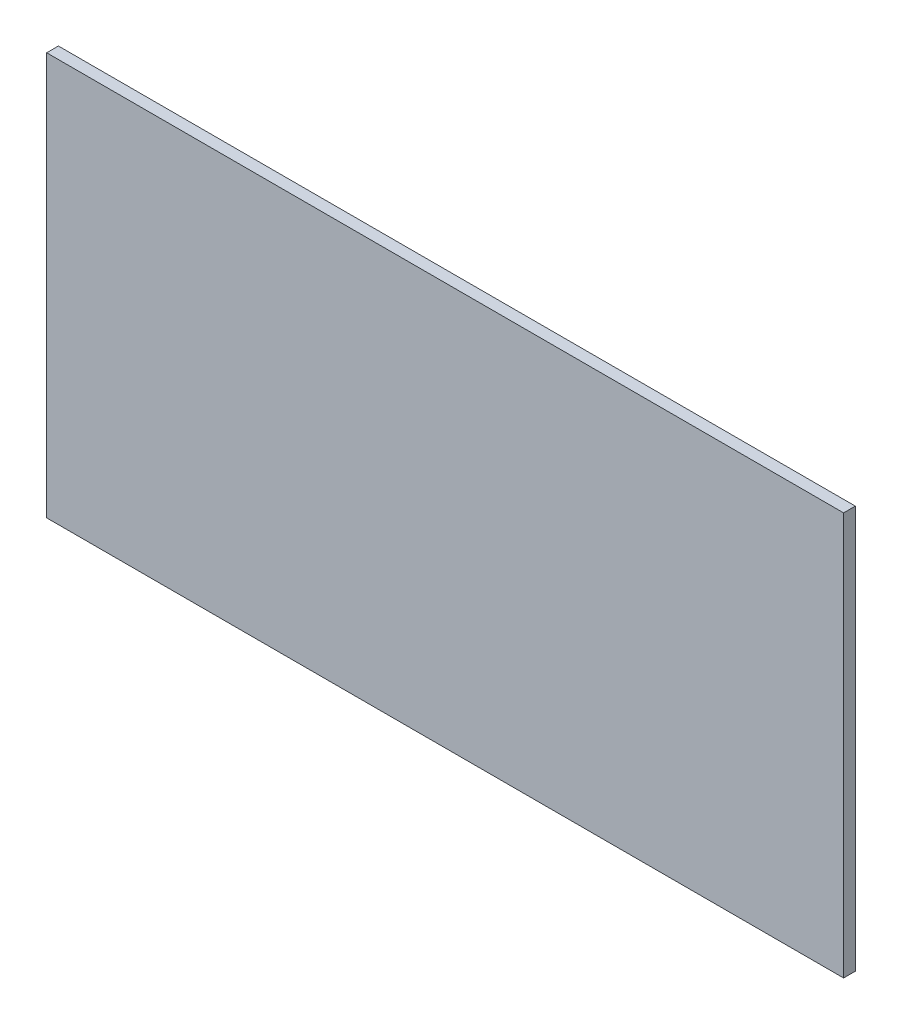
from build123d import *

# Parameters (mm, degrees)
SKETCH1_W           = 108.780149608
SKETCH1_H           = 54.985586572
BOSS_EXTRUDE1_DEPTH = 1.6


with BuildPart() as part:
    # Sketch1 → Boss-Extrude1 (new body)
    with BuildSketch(Plane.XY):
        Rectangle(SKETCH1_W, SKETCH1_H)
    extrude(amount=BOSS_EXTRUDE1_DEPTH)


solid = part.part
